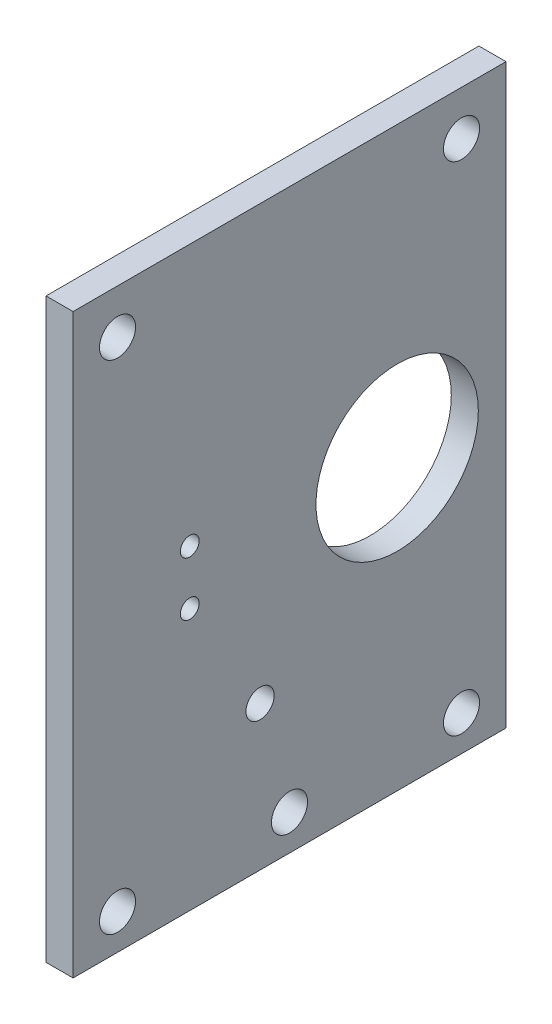
from build123d import *

# Parameters (mm, degrees)
SKETCH2_W            = 76.2
SKETCH2_H            = 101.6
BOSS_EXTRUDE1_DEPTH  = 4.7625
SKETCH3_R            = 3.175
CUT_EXTRUDE1_DEPTH   = 6.35
SKETCH3_4_R          = 3.175
SKETCH3_4_R_2        = 14.2875
SKETCH3_4_R_3        = 2.4892
CUT_EXTRUDE2_DEPTH   = 6.35
M6_CLEARANCE_HOLE1_D = 3.3


with BuildPart() as part:
    # Sketch2 → Boss-Extrude1 (new body)
    with BuildSketch(Plane(origin=(0, 0, 0), x_dir=(0, 0, -1), z_dir=(1, 0, 0))):
        Rectangle(SKETCH2_W, SKETCH2_H)
    extrude(amount=BOSS_EXTRUDE1_DEPTH)

    # Sketch3 → Cut-Extrude1 (cut)
    with BuildSketch(Plane(origin=(4.7625, 0, 0), x_dir=(0, 0, -1), z_dir=(1, 0, 0))):
        with Locations((30.2768, 42.9768)):
            Circle(SKETCH3_R)
    extrude(amount=-CUT_EXTRUDE1_DEPTH, mode=Mode.SUBTRACT)

    # Sketch3<4> → Cut-Extrude2 (cut)
    with BuildSketch(Plane(origin=(4.7625, 0, 0), x_dir=(0, 0, -1), z_dir=(1, 0, 0))):
        with Locations((30.2768, -44.5643)):
            Circle(SKETCH3_4_R)
        with Locations((30.2768, 42.9768)):
            Circle(SKETCH3_4_R)
        with Locations((-30.2768, 42.9768)):
            Circle(SKETCH3_4_R)
        with Locations((-30.2768, -44.5643)):
            Circle(SKETCH3_4_R)
        with Locations((18.9484, 0)):
            Circle(SKETCH3_4_R_2)
        with Locations((-5.1816, -25.4)):
            Circle(SKETCH3_4_R_3)
        with Locations((0, -44.5643)):
            Circle(SKETCH3_4_R)
    extrude(amount=-CUT_EXTRUDE2_DEPTH, mode=Mode.SUBTRACT)

    # M6 Clearance Hole1 (through all)
    with Locations(Plane(origin=(4.7625, 0, 0), x_dir=(0, 0, -1), z_dir=(1, 0, 0))):
        with Locations((-17.5641, 4.7625), (-17.5641, -4.7625)):
            Hole(M6_CLEARANCE_HOLE1_D / 2)


solid = part.part
